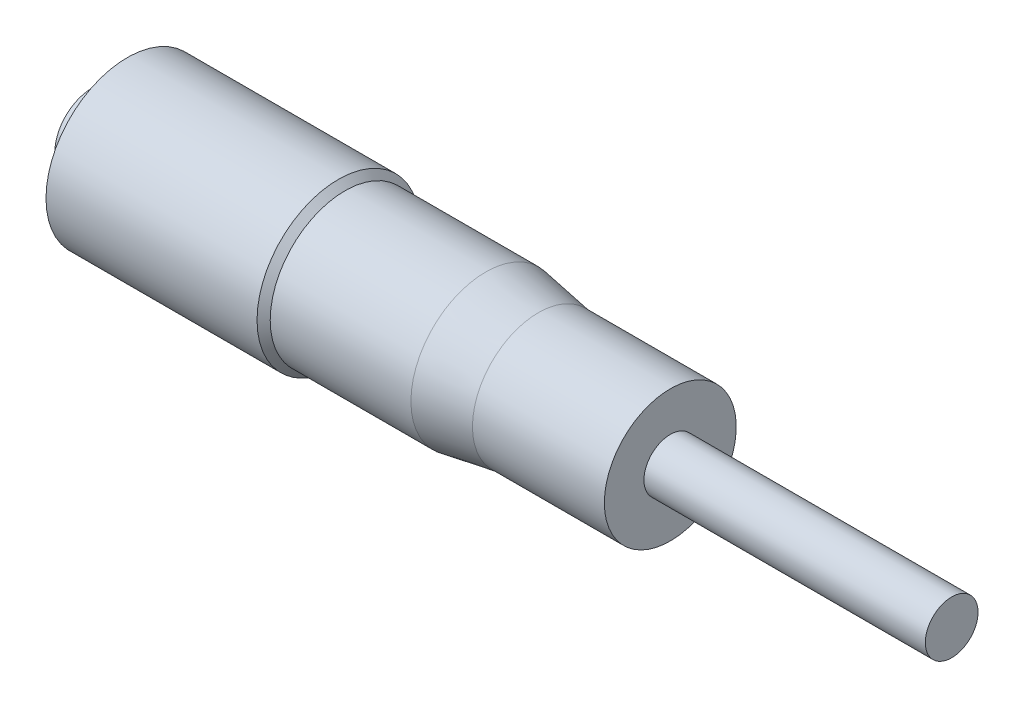
from build123d import *


with BuildPart() as part:
    # Sketch1 → Revolve1 (revolve)
    with BuildSketch(Plane.XY, mode=Mode.PRIVATE) as revolve1_sk:
        with BuildLine():
            Line((-49.375, 0), (49.375, 0))
            Line((49.375, 0), (49.375, 3))
            Line((49.375, 3), (17.375, 3))
            Line((17.375, 3), (17.375, 7.5))
            Line((17.375, 7.5), (2.375, 7.5))
            Line((2.375, 7.5), (-3.625, 8.5))
            Line((-3.625, 8.5), (-19.625, 8.5))
            Line((-19.625, 8.5), (-20.375, 9.25))
            Line((-20.375, 9.25), (-44.375, 9.25))
            Line((-44.375, 9.25), (-45.875, 4.25))
            Line((-45.875, 4.25), (-48.375, 4.25))
            ThreePointArc((-48.375, 4.25), (-49.121632386, 2.18303115), (-49.375, 0))
        make_face()
    revolve(revolve1_sk.sketch.rotate(Axis((0, 0, 0), (1, 0, 0)), 90), axis=Axis((0, 0, 0), (1, 0, 0)))


solid = part.part
